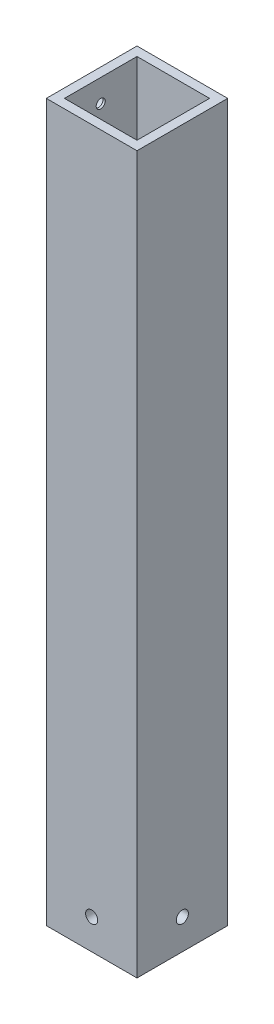
from build123d import *

# Parameters (mm, degrees)
CROQUIS1_W               = 30
CROQUIS1_H               = 30
CROQUIS1_W_2             = 26
CROQUIS1_H_2             = 26
SALIENTE_EXTRUIR3_DEPTH  = 230
CROQUIS2_W               = 62.135011277
CROQUIS2_H               = 81.929382736
CORTAR_EXTRUIR3_DEPTH    = 28
CROQUIS3_R               = 2
CORTAR_EXTRUIR9_DEPTH    = 15
CROQUIS4_R               = 2
CORTAR_EXTRUIR10_DEPTH   = 15
CROQUIS5_W               = 30
CROQUIS5_H               = 30
CROQUIS5_W_2             = 26
CROQUIS5_H_2             = 26
SALIENTE_EXTRUIR6_DEPTH  = 12
CROQUIS7_W               = 18.119956634
CROQUIS7_H               = 38.019551867
SALIENTE_EXTRUIR7_DEPTH  = 2
CROQUIS8_W               = 19.256572939
CROQUIS8_H               = 35.130037486
SALIENTE_EXTRUIR8_DEPTH  = 2
CROQUIS9_R               = 2
CORTAR_EXTRUIR11_DEPTH   = 2
CROQUIS10_R              = 2
CORTAR_EXTRUIR12_DEPTH   = 2
CROQUIS11_W              = 68.798737931
CROQUIS11_H              = 42.92716572
CORTAR_EXTRUIR14_DEPTH   = 2
CROQUIS12_R              = 2
SALIENTE_EXTRUIR9_DEPTH  = 2
CROQUIS13_R              = 2
SALIENTE_EXTRUIR10_DEPTH = 2
CROQUIS14_R              = 1.5
CORTAR_EXTRUIR18_DEPTH   = 20
CROQUIS16_W              = 26
CROQUIS16_H              = 26
CROQUIS16_W_2            = 24
CROQUIS16_H_2            = 24
SALIENTE_EXTRUIR11_DEPTH = 212
CROQUIS17_R              = 1.5
CORTAR_EXTRUIR20_DEPTH   = 6
CROQUIS18_R              = 2.5
CORTAR_EXTRUIR21_DEPTH   = 2.25
CROQUIS19_W              = 30
CROQUIS19_H              = 30
CROQUIS19_W_2            = 24
CROQUIS19_H_2            = 24
SALIENTE_EXTRUIR12_DEPTH = 30
CROQUIS20_R              = 2
SALIENTE_EXTRUIR13_DEPTH = 2
CROQUIS21_R              = 2
SALIENTE_EXTRUIR14_DEPTH = 2
CROQUIS22_R              = 2
CORTAR_EXTRUIR22_DEPTH   = 52
CROQUIS23_R              = 2
CORTAR_EXTRUIR23_DEPTH   = 52
CROQUIS24_W              = 34.498036884
CROQUIS24_H              = 39.991384426
CORTAR_EXTRUIR24_DEPTH   = 5


with BuildPart() as part:
    # Croquis1 → Saliente-Extruir3 (new body)
    with BuildSketch(Plane(origin=(0, 0, 0), x_dir=(1, 0, 0), z_dir=(0, 1, 0))):
        Rectangle(CROQUIS1_W, CROQUIS1_H)
        Rectangle(CROQUIS1_W_2, CROQUIS1_H_2, mode=Mode.SUBTRACT)
    extrude(amount=SALIENTE_EXTRUIR3_DEPTH)

    # Croquis2 → Cortar-Extruir3 (cut)
    with BuildSketch(Plane(origin=(0, 230, 0), x_dir=(1, 0, 0), z_dir=(0, 1, 0))):
        with Locations((9.148629236, 2.703749702)):
            Rectangle(CROQUIS2_W, CROQUIS2_H)
    extrude(amount=-CORTAR_EXTRUIR3_DEPTH, mode=Mode.SUBTRACT)

    # Croquis3 → Cortar-Extruir9 (cut)
    with BuildSketch(Plane.XY.offset(15)):
        with Locations((3, 169)):
            Circle(CROQUIS3_R)
        with Locations((-3, 191)):
            Circle(CROQUIS3_R)
        with Locations((-3, 33)):
            Circle(CROQUIS3_R)
        with Locations((3, 11)):
            Circle(CROQUIS3_R)
    extrude(amount=-CORTAR_EXTRUIR9_DEPTH, mode=Mode.SUBTRACT)

    # Croquis4 → Cortar-Extruir10 (cut)
    with BuildSketch(Plane(origin=(0, 0, -15), x_dir=(-1, 0, 0), z_dir=(0, 0, -1))):
        with Locations((-3, 191)):
            Circle(CROQUIS4_R)
        with Locations((3, 169)):
            Circle(CROQUIS4_R)
        with Locations((3, 11)):
            Circle(CROQUIS4_R)
        with Locations((-3, 33)):
            Circle(CROQUIS4_R)
    extrude(amount=-CORTAR_EXTRUIR10_DEPTH, mode=Mode.SUBTRACT)

    # Croquis5 → Saliente-Extruir6 (add)
    with BuildSketch(Plane(origin=(0, 202, 0), x_dir=(1, 0, 0), z_dir=(0, 1, 0))):
        Rectangle(CROQUIS5_W, CROQUIS5_H)
        Rectangle(CROQUIS5_W_2, CROQUIS5_H_2, mode=Mode.SUBTRACT)
    extrude(amount=SALIENTE_EXTRUIR6_DEPTH)

    # Croquis7 → Saliente-Extruir7 (add)
    with BuildSketch(Plane.XY.offset(15)):
        with Locations((-0.954536797, 182.456683749)):
            Rectangle(CROQUIS7_W, CROQUIS7_H)
    extrude(amount=-SALIENTE_EXTRUIR7_DEPTH)

    # Croquis8 → Saliente-Extruir8 (add)
    with BuildSketch(Plane(origin=(0, 0, -15), x_dir=(-1, 0, 0), z_dir=(0, 0, -1))):
        with Locations((1.596533726, 178.910609938)):
            Rectangle(CROQUIS8_W, CROQUIS8_H)
    extrude(amount=-SALIENTE_EXTRUIR8_DEPTH)

    # Croquis9 → Cortar-Extruir11 (cut)
    with BuildSketch(Plane.XY.offset(15)):
        with Locations((-3, 203)):
            Circle(CROQUIS9_R)
        with Locations((3, 181)):
            Circle(CROQUIS9_R)
    extrude(amount=-CORTAR_EXTRUIR11_DEPTH, mode=Mode.SUBTRACT)

    # Croquis10 → Cortar-Extruir12 (cut)
    with BuildSketch(Plane(origin=(0, 0, -15), x_dir=(-1, 0, 0), z_dir=(0, 0, -1))):
        with Locations((-3, 203)):
            Circle(CROQUIS10_R)
        with Locations((3, 181)):
            Circle(CROQUIS10_R)
    extrude(amount=-CORTAR_EXTRUIR12_DEPTH, mode=Mode.SUBTRACT)

    # Croquis11 → Cortar-Extruir14 (cut)
    with BuildSketch(Plane(origin=(0, 214, 0), x_dir=(1, 0, 0), z_dir=(0, 1, 0))):
        with Locations((-6.144488578, -0.254830212)):
            Rectangle(CROQUIS11_W, CROQUIS11_H)
    extrude(amount=-CORTAR_EXTRUIR14_DEPTH, mode=Mode.SUBTRACT)

    # Croquis12 → Saliente-Extruir9 (add)
    with BuildSketch(Plane(origin=(0, 0, -15), x_dir=(-1, 0, 0), z_dir=(0, 0, -1))):
        with Locations((3, 181)):
            Circle(CROQUIS12_R)
        with Locations((-3, 203)):
            Circle(CROQUIS12_R)
    extrude(amount=-SALIENTE_EXTRUIR9_DEPTH)

    # Croquis13 → Saliente-Extruir10 (add)
    with BuildSketch(Plane.XY.offset(15)):
        with Locations((-3, 203)):
            Circle(CROQUIS13_R)
        with Locations((3, 181)):
            Circle(CROQUIS13_R)
    extrude(amount=-SALIENTE_EXTRUIR10_DEPTH)

    # Croquis14 → Cortar-Extruir18 (cut)
    with BuildSketch(Plane.ZY.offset(15)):
        with Locations((0, 204.5)):
            Circle(CROQUIS14_R)
    extrude(amount=-CORTAR_EXTRUIR18_DEPTH, mode=Mode.SUBTRACT)

    # Croquis16 → Saliente-Extruir11 (add)
    with BuildSketch(Plane(origin=(0, 212, 0), x_dir=(1, 0, 0), z_dir=(0, 1, 0))):
        Rectangle(CROQUIS16_W, CROQUIS16_H)
        Rectangle(CROQUIS16_W_2, CROQUIS16_H_2, mode=Mode.SUBTRACT)
    extrude(amount=-SALIENTE_EXTRUIR11_DEPTH)

    # Croquis17 → Cortar-Extruir20 (cut)
    with BuildSketch(Plane.ZY.offset(13)):
        with Locations((0, 204.5)):
            Circle(CROQUIS17_R)
    extrude(amount=-CORTAR_EXTRUIR20_DEPTH, mode=Mode.SUBTRACT)

    # Croquis18 → Cortar-Extruir21 (cut)
    with BuildSketch(Plane.ZY.offset(15)):
        with Locations((0, 204.5)):
            Circle(CROQUIS18_R)
    extrude(amount=-CORTAR_EXTRUIR21_DEPTH, mode=Mode.SUBTRACT)

    # Croquis19 → Saliente-Extruir12 (add)
    with BuildSketch(Plane.XZ):
        Rectangle(CROQUIS19_W, CROQUIS19_H)
        Rectangle(CROQUIS19_W_2, CROQUIS19_H_2, mode=Mode.SUBTRACT)
    extrude(amount=SALIENTE_EXTRUIR12_DEPTH)

    # Croquis20 → Saliente-Extruir13 (add)
    with BuildSketch(Plane.XY.offset(15)):
        with Locations((3, 11)):
            Circle(CROQUIS20_R)
        with Locations((-3, 33)):
            Circle(CROQUIS20_R)
    extrude(amount=-SALIENTE_EXTRUIR13_DEPTH)

    # Croquis21 → Saliente-Extruir14 (add)
    with BuildSketch(Plane(origin=(0, 0, -15), x_dir=(-1, 0, 0), z_dir=(0, 0, -1))):
        with Locations((3, 11)):
            Circle(CROQUIS21_R)
        with Locations((-3, 33)):
            Circle(CROQUIS21_R)
    extrude(amount=-SALIENTE_EXTRUIR14_DEPTH)

    # Croquis22 → Cortar-Extruir22 (cut)
    with BuildSketch(Plane.ZY.offset(15)):
        with Locations((0, -15)):
            Circle(CROQUIS22_R)
    extrude(amount=-CORTAR_EXTRUIR22_DEPTH, mode=Mode.SUBTRACT)

    # Croquis23 → Cortar-Extruir23 (cut)
    with BuildSketch(Plane(origin=(0, 0, -15), x_dir=(-1, 0, 0), z_dir=(0, 0, -1))):
        with Locations((0, -15)):
            Circle(CROQUIS23_R)
    extrude(amount=-CORTAR_EXTRUIR23_DEPTH, mode=Mode.SUBTRACT)

    # Croquis24 → Cortar-Extruir24 (cut)
    with BuildSketch(Plane(origin=(0, -30, 0), x_dir=(-1, 0, 0), z_dir=(0, -1, 0))):
        with Locations((0.940748802, -0.242239461)):
            Rectangle(CROQUIS24_W, CROQUIS24_H)
    extrude(amount=-CORTAR_EXTRUIR24_DEPTH, mode=Mode.SUBTRACT)


solid = part.part
